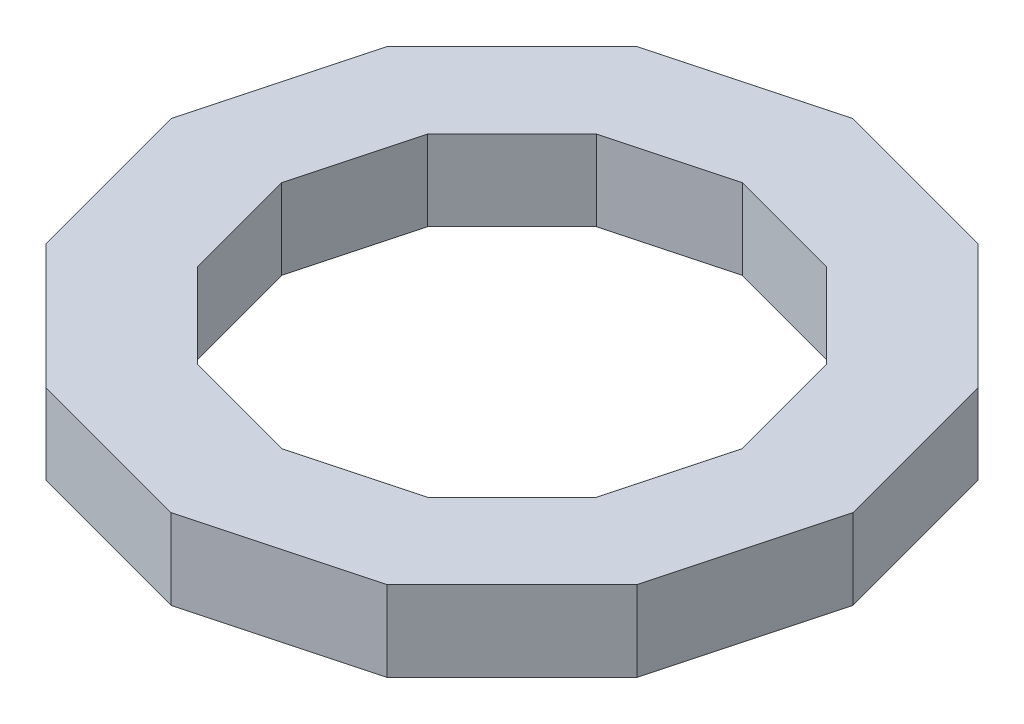
from build123d import *

# Parameters (mm, degrees)
BOSS_EXTRUDE1_DEPTH = 19.05


with BuildPart() as part:
    # Sketch1 → Boss-Extrude1 (new body)
    with BuildSketch(Plane(origin=(0, 0, 0), x_dir=(1, 0, 0), z_dir=(0, 1, 0))):
        Polygon((80.96390276, 0), (70.116796579, 40.48195138), (40.48195138, 70.116796579), (0, 80.96390276), (-40.48195138, 70.116796579), (-70.116796579, 40.48195138), (-80.96390276, 0), (-70.116796579, -40.48195138), (-40.48195138, -70.116796579), (0, -80.96390276), (40.48195138, -70.116796579), (70.116796579, -40.48195138), align=None)
        Polygon((54.667887777, 0), (47.343779586, 27.333943889), (27.333943889, 47.343779586), (0, 54.667887777), (-27.333943889, 47.343779586), (-47.343779586, 27.333943889), (-54.667887777, 0), (-47.343779586, -27.333943889), (-27.333943889, -47.343779586), (0, -54.667887777), (27.333943889, -47.343779586), (47.343779586, -27.333943889), align=None, mode=Mode.SUBTRACT)
    extrude(amount=BOSS_EXTRUDE1_DEPTH)


solid = part.part
